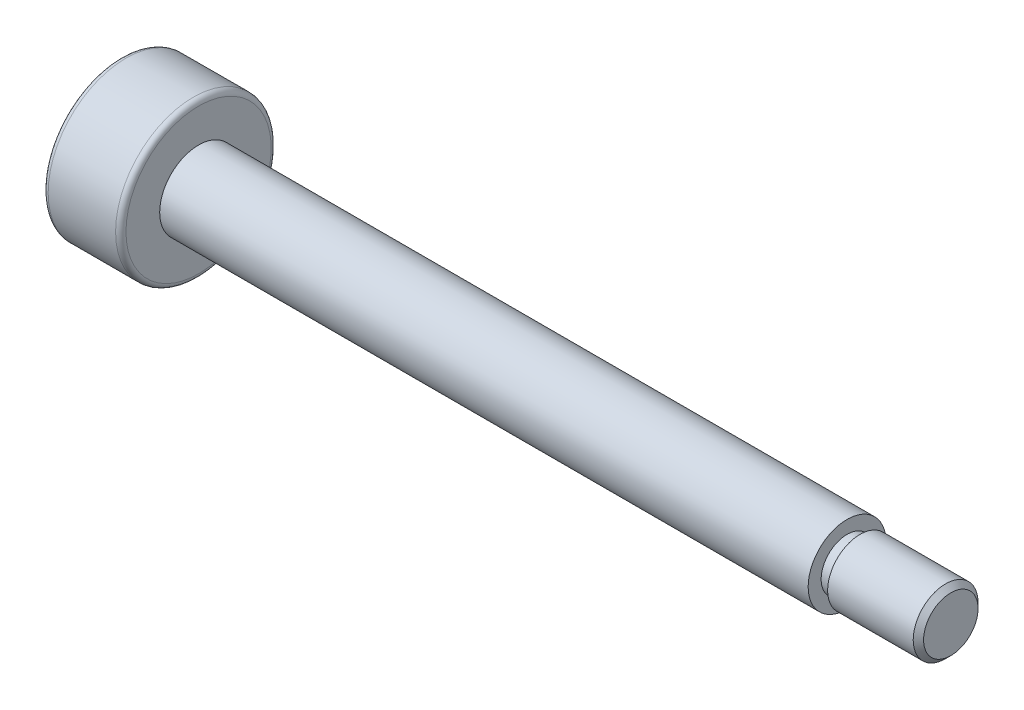
from build123d import *

# Parameters (mm, degrees)
FILLET_1_R          = 0.2
CHAMFER_1_SIZE      = 0.2
SKETCH_3_W          = 0.5
SKETCH_3_H          = 0.25
CUT_EXTRUDE_1_DEPTH = 2


with BuildPart() as part:
    # 草图1 → 旋转1 (revolve)
    with BuildSketch(Plane.XY, mode=Mode.PRIVATE) as revolve_1_sk:
        Polygon((-16, 0), (-16, 3), (-13, 3), (-13, 1.5), (12, 1.5), (12, 1.25), (16, 1.25), (16, 0), align=None)
    revolve(revolve_1_sk.sketch.rotate(Axis((-16, 0, 0), (1, 0, 0)), 90), axis=Axis((-16, 0, 0), (1, 0, 0)))

    # 圆角1
    fillet_1_edges = [part.edges().sort_by_distance(p)[0] for p in [
        (-13, 0, -3),
        (-16, 0, -3),
    ]]
    fillet(fillet_1_edges, radius=FILLET_1_R)

    # 倒角1
    chamfer_1_edges = [part.edges().sort_by_distance(p)[0] for p in [
        (16, 0, -1.25),
    ]]
    chamfer(chamfer_1_edges, length=CHAMFER_1_SIZE)

    # 草图3 → 切除-旋转1 (revolve, cut)
    with BuildSketch(Plane.XY, mode=Mode.PRIVATE) as cut_revolve_1_sk:
        with Locations((12.25, 1.125)):
            Rectangle(SKETCH_3_W, SKETCH_3_H)
    revolve(cut_revolve_1_sk.sketch.rotate(Axis((12, 0, 0), (1, 0, 0)), 90), axis=Axis((12, 0, 0), (1, 0, 0)), mode=Mode.SUBTRACT)

    # 草图4 → 切除-拉伸1 (cut)
    with BuildSketch(Plane.ZY.offset(16)):
        Polygon((1.732050808, 0), (0.866025404, 1.5), (-0.866025404, 1.5), (-1.732050808, 0), (-0.866025404, -1.5), (0.866025404, -1.5), align=None)
    extrude(amount=-CUT_EXTRUDE_1_DEPTH, mode=Mode.SUBTRACT)


solid = part.part
